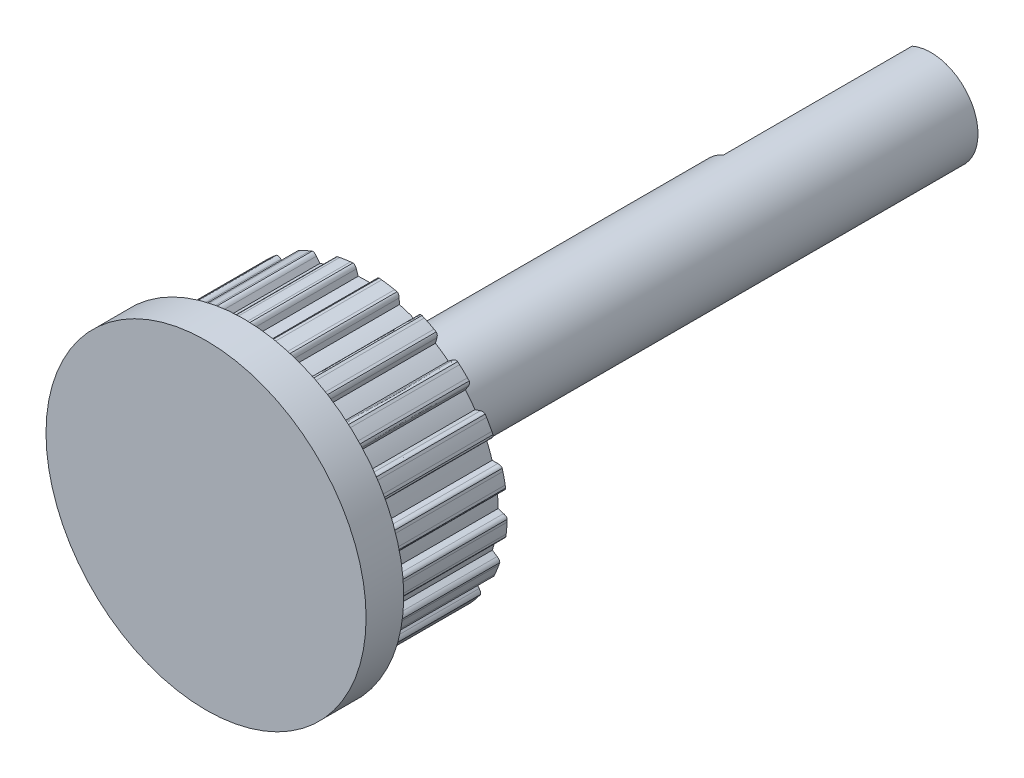
from build123d import *

# Parameters (mm, degrees)
ESQUISSE1_R                  = 7.5
BOSS_EXTRU_1_DEPTH           = 6.5
ENL_V_MAT_EXTRU_1_REACH      = 14.44
R_P_TITION_CIRCULAIRE1_COUNT = 21
R_P_TITION_CIRCULAIRE1_ANGLE = 342
ESQUISSE3_R                  = 8.5
BOSS_EXTRU_2_DEPTH           = 2
ESQUISSE4_R                  = 2.5
BOSS_EXTRU_3_DEPTH           = 30
ESQUISSE5_W                  = 3
ESQUISSE5_H                  = 6.582761744
ENL_V_MAT_EXTRU_2_DEPTH      = 10


with BuildPart() as part:
    # Esquisse1 → Boss.-Extru.1 (new body)
    with BuildSketch(Plane.XY):
        Circle(ESQUISSE1_R)
    extrude(amount=BOSS_EXTRU_1_DEPTH)

    # Esquisse2 → Enlèv. mat.-Extru.1 (cut, up to next)
    with BuildSketch(Plane.XY.offset(6.5), mode=Mode.PRIVATE) as enl_v_mat_extru_1_sk1:
        with BuildLine():
            Line((0.415, 7), (0.518268593, 7.283728127))
            add(Edge.make_bspline(
                [(0.518268593, 7.283728127), (0.579760376, 7.452675414), (0.695, 7.467728905)],
                knots=[0, 0, 0, 1, 1, 1], degree=2))
            Line((0.695, 7.467728905), (0.83, 7.453931848))
            Line((0.83, 7.453931848), (0.83, 7.597862182))
            Line((0.83, 7.597862182), (-0.83, 7.597862182))
            Line((-0.83, 7.597862182), (-0.83, 7.453931848))
            Line((-0.83, 7.453931848), (-0.695, 7.467728905))
            add(Edge.make_bspline(
                [(-0.518268593, 7.283728127), (-0.579760376, 7.452675414), (-0.695, 7.467728905)],
                knots=[0, 0, 0, 1, 1, 1], degree=2))
            Line((-0.518268593, 7.283728127), (-0.415, 7))
            ThreePointArc((-0.415, 7), (0, 7.012290995), (0.415, 7))
        make_face()
    enl_v_mat_extru_1_tool1 = extrude(enl_v_mat_extru_1_sk1.sketch, amount=-ENL_V_MAT_EXTRU_1_REACH, mode=Mode.PRIVATE) & part.part
    enl_v_mat_extru_1 = enl_v_mat_extru_1_tool1.solids().sort_by_distance((0, 7.342065, 6.5))[0]
    add(enl_v_mat_extru_1, mode=Mode.SUBTRACT)

    # Répétition circulaire1: Enlèv. mat.-Extru.1 ×21 about axis
    r_p_tition_circulaire1_axis = Axis((0, 0, 6.5), (0, 0, 1))
    for i in range(1, R_P_TITION_CIRCULAIRE1_COUNT):
        add(enl_v_mat_extru_1.rotate(r_p_tition_circulaire1_axis, i * R_P_TITION_CIRCULAIRE1_ANGLE / (R_P_TITION_CIRCULAIRE1_COUNT - 1)), mode=Mode.SUBTRACT)

    # Esquisse3 → Boss.-Extru.2 (add)
    with BuildSketch(Plane.XY.offset(6.5)):
        Circle(ESQUISSE3_R)
    extrude(amount=BOSS_EXTRU_2_DEPTH)

    # Esquisse4 → Boss.-Extru.3 (add)
    with BuildSketch(Plane(origin=(0, 0, 0), x_dir=(-1, 0, 0), z_dir=(0, 0, -1))):
        Circle(ESQUISSE4_R)
    extrude(amount=BOSS_EXTRU_3_DEPTH)

    # Esquisse5 → Enlèv. mat.-Extru.2 (cut)
    with BuildSketch(Plane(origin=(0, 0, -30), x_dir=(-1, 0, 0), z_dir=(0, 0, -1))):
        with Locations((2.5, 0)):
            Rectangle(ESQUISSE5_W, ESQUISSE5_H)
    extrude(amount=-ENL_V_MAT_EXTRU_2_DEPTH, mode=Mode.SUBTRACT)


solid = part.part
